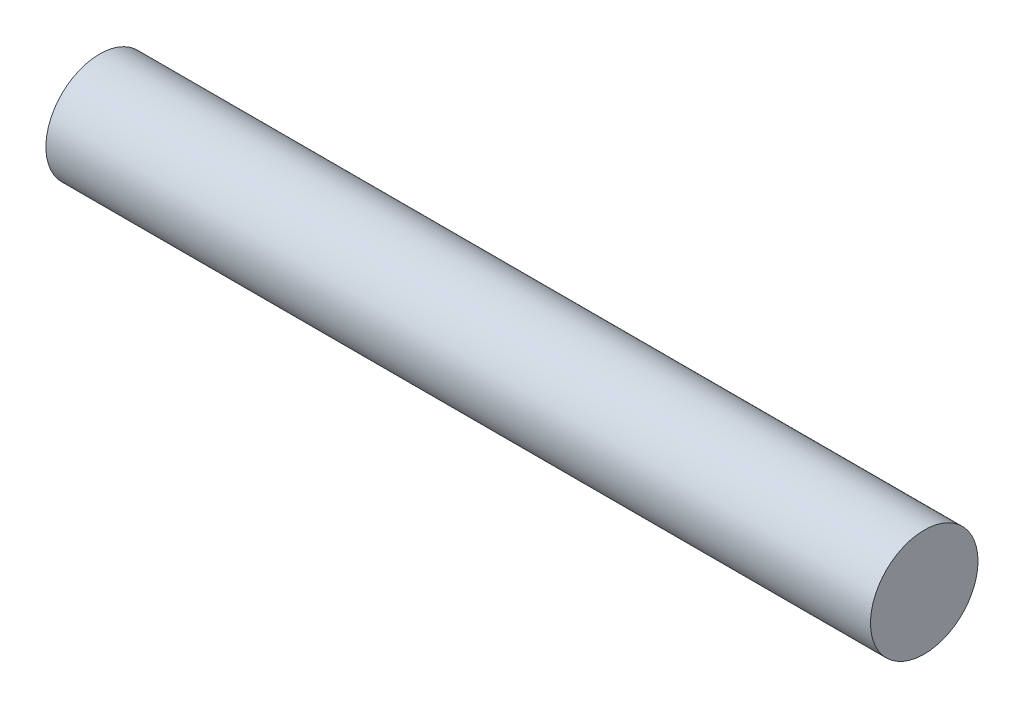
from build123d import *

# Parameters (mm, degrees)
BOSS_EXTRUDE1_DEPTH      = 3.2
BOSS_EXTRUDE1_DEPTH_BACK = 133.2
SKETCH1_R                = 8.89


with BuildPart() as part:
    # Sketch1 → Boss-Extrude1 (new, two sides: drawn at the far end of the back side and taken through both)
    with BuildSketch(Plane(origin=(0, 0, 0), x_dir=(0, 0, -1), z_dir=(1, 0, 0)).offset(-BOSS_EXTRUDE1_DEPTH_BACK)):
        Circle(SKETCH1_R)
    extrude(amount=BOSS_EXTRUDE1_DEPTH + BOSS_EXTRUDE1_DEPTH_BACK)


solid = part.part
